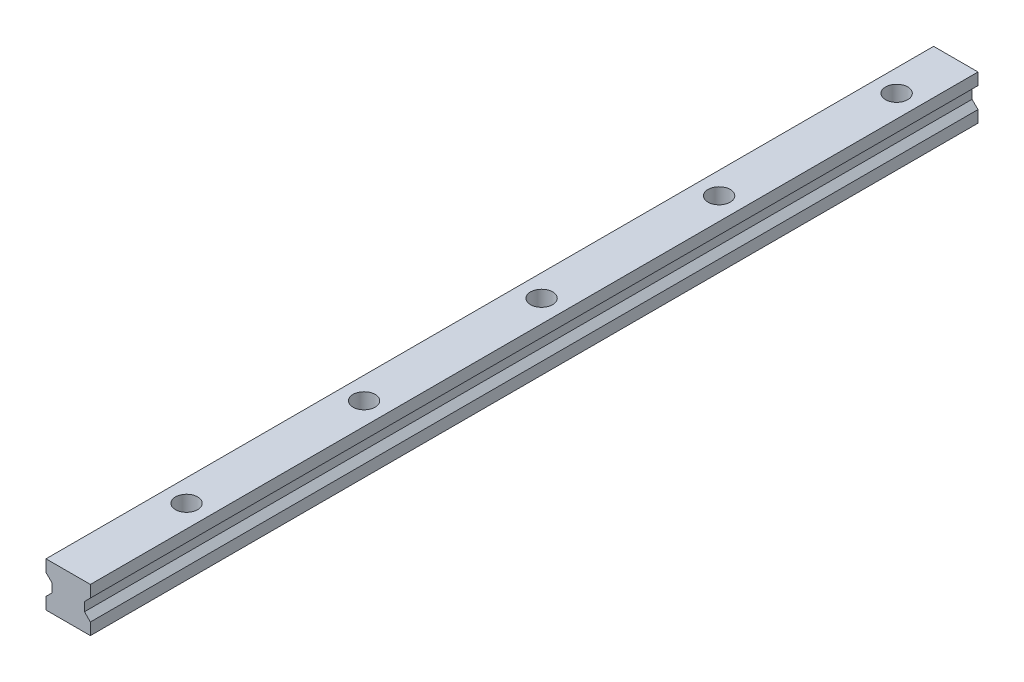
from build123d import *

# Parameters (mm, degrees)
BOSS_EXTRUDE1_DEPTH = 300
SKETCH2_R           = 3.75
CUT_EXTRUDE1_DEPTH  = 5.3
SKETCH3_R           = 2.25
CUT_EXTRUDE2_DEPTH  = 301.46838436


with BuildPart() as part:
    # Sketch1 → Boss-Extrude1 (new body)
    with BuildSketch(Plane.XY):
        Polygon((-7.5, 0), (7.5, 0), (7.5, 4), (5.5, 6), (5.5, 9), (7.5, 11), (7.5, 15), (-7.5, 15), (-7.5, 11), (-5.5, 9), (-5.5, 6), (-7.5, 4), align=None)
    extrude(amount=BOSS_EXTRUDE1_DEPTH)

    # Sketch2 → Cut-Extrude1 (cut)
    with BuildSketch(Plane(origin=(0, 15, 0), x_dir=(1, 0, 0), z_dir=(0, 1, 0))):
        with Locations(Location((0, -20, 0), (0, 0, 270))):
            Circle(SKETCH2_R)
        with Locations(Location((0, -80, 0), (0, 0, 270))):
            Circle(SKETCH2_R)
        with Locations(Location((0, -140, 0), (0, 0, 270))):
            Circle(SKETCH2_R)
        with Locations(Location((0, -200, 0), (0, 0, 270))):
            Circle(SKETCH2_R)
        with Locations(Location((0, -260, 0), (0, 0, 270))):
            Circle(SKETCH2_R)
    extrude(amount=-CUT_EXTRUDE1_DEPTH, mode=Mode.SUBTRACT)

    # Sketch3 → Cut-Extrude2 (cut, through all)
    with BuildSketch(Plane(origin=(0, 15, 0), x_dir=(1, 0, 0), z_dir=(0, 1, 0))):
        with Locations(Location((0, -20, 0), (0, 0, 270))):
            Circle(SKETCH3_R)
        with Locations(Location((0, -80, 0), (0, 0, 270))):
            Circle(SKETCH3_R)
        with Locations(Location((0, -140, 0), (0, 0, 270))):
            Circle(SKETCH3_R)
        with Locations(Location((0, -200, 0), (0, 0, 270))):
            Circle(SKETCH3_R)
        with Locations(Location((0, -260, 0), (0, 0, 270))):
            Circle(SKETCH3_R)
    extrude(amount=-CUT_EXTRUDE2_DEPTH, mode=Mode.SUBTRACT)


solid = part.part
